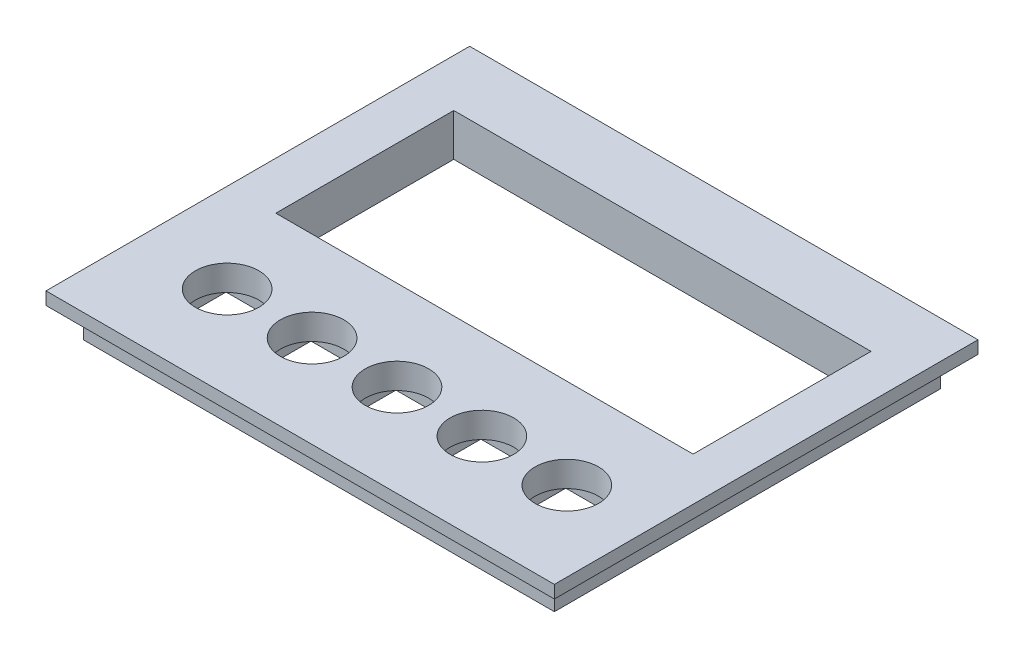
from build123d import *

# Parameters (mm, degrees)
SKETCH1_W           = 120
SKETCH1_H           = 100
BOSS_EXTRUDE1_DEPTH = 10
SKETCH2_W           = 98.5
SKETCH2_H           = 42
CUT_EXTRUDE1_DEPTH  = 10
SKETCH3_W           = 120
SKETCH3_H           = 100
SKETCH3_W_2         = 111.2
SKETCH3_H_2         = 91.2
CUT_EXTRUDE3_DEPTH  = 7
SKETCH4_W           = 18
SKETCH4_H           = 25
CUT_EXTRUDE4_DEPTH  = 4
SKETCH5_W           = 1
SKETCH5_H           = 25
CUT_EXTRUDE6_DEPTH  = 2.5
SKETCH6_R           = 7.49
CUT_EXTRUDE12_DEPTH = 80.892767694


with BuildPart() as part:
    # Sketch1 → Boss-Extrude1 (new body)
    with BuildSketch(Plane(origin=(0, 0, 0), x_dir=(1, 0, 0), z_dir=(0, 1, 0))):
        with Locations((0.311320755, 2.051886792)):
            Rectangle(SKETCH1_W, SKETCH1_H)
    extrude(amount=BOSS_EXTRUDE1_DEPTH)

    # Sketch2 → Cut-Extrude1 (cut)
    with BuildSketch(Plane(origin=(0, 10, 0), x_dir=(1, 0, 0), z_dir=(0, 1, 0))):
        with Locations((0.811320755, 16.051886792)):
            Rectangle(SKETCH2_W, SKETCH2_H)
    extrude(amount=-CUT_EXTRUDE1_DEPTH, mode=Mode.SUBTRACT)

    # Sketch3 → Cut-Extrude3 (cut)
    with BuildSketch(Plane.XZ):
        with Locations((0.311320755, -2.051886792)):
            Rectangle(SKETCH3_W, SKETCH3_H)
        with Locations((0.311320755, -2.051886792)):
            Rectangle(SKETCH3_W_2, SKETCH3_H_2, mode=Mode.SUBTRACT)
    extrude(amount=-CUT_EXTRUDE3_DEPTH, mode=Mode.SUBTRACT)

    # Sketch4 → Cut-Extrude4 (cut)
    with BuildSketch(Plane.XZ):
        with Locations((-39.17934754, 29.448113208)):
            Rectangle(SKETCH4_W, SKETCH4_H)
        with Locations((-19.133803456, 29.448113208)):
            Rectangle(SKETCH4_W, SKETCH4_H)
        with Locations((0.911740628, 29.448113208)):
            Rectangle(SKETCH4_W, SKETCH4_H)
        with Locations((20.957284712, 29.448113208)):
            Rectangle(SKETCH4_W, SKETCH4_H)
        with Locations((41.002828796, 29.448113208)):
            Rectangle(SKETCH4_W, SKETCH4_H)
    extrude(amount=-CUT_EXTRUDE4_DEPTH, mode=Mode.SUBTRACT)

    # Sketch5 → Cut-Extrude6 (cut)
    with BuildSketch(Plane.XZ.offset(-4)):
        with Locations((32.502828796, 29.448113208)):
            Rectangle(SKETCH5_W, SKETCH5_H)
        with Locations((12.457284712, 29.448113208)):
            Rectangle(SKETCH5_W, SKETCH5_H)
        with Locations((-7.588259372, 29.448113208)):
            Rectangle(SKETCH5_W, SKETCH5_H)
        with Locations((-27.633803456, 29.448113208)):
            Rectangle(SKETCH5_W, SKETCH5_H)
        with Locations((-47.67934754, 29.448113208)):
            Rectangle(SKETCH5_W, SKETCH5_H)
    extrude(amount=-CUT_EXTRUDE6_DEPTH, mode=Mode.SUBTRACT)

    # Sketch6 → Cut-Extrude12 (cut, through all)
    with BuildSketch(Plane.XZ.offset(-4)):
        with Locations(Location((41.502828796, 26.198113208, 0), (0, 0, 270))):
            Circle(SKETCH6_R)
        with Locations(Location((21.457284712, 26.198113208, 0), (0, 0, 270))):
            Circle(SKETCH6_R)
        with Locations(Location((1.411740628, 26.198113208, 0), (0, 0, 270))):
            Circle(SKETCH6_R)
        with Locations(Location((-18.633803456, 26.198113208, 0), (0, 0, 270))):
            Circle(SKETCH6_R)
        with Locations(Location((-38.67934754, 26.198113208, 0), (0, 0, 270))):
            Circle(SKETCH6_R)
    extrude(amount=-CUT_EXTRUDE12_DEPTH, mode=Mode.SUBTRACT)


solid = part.part
